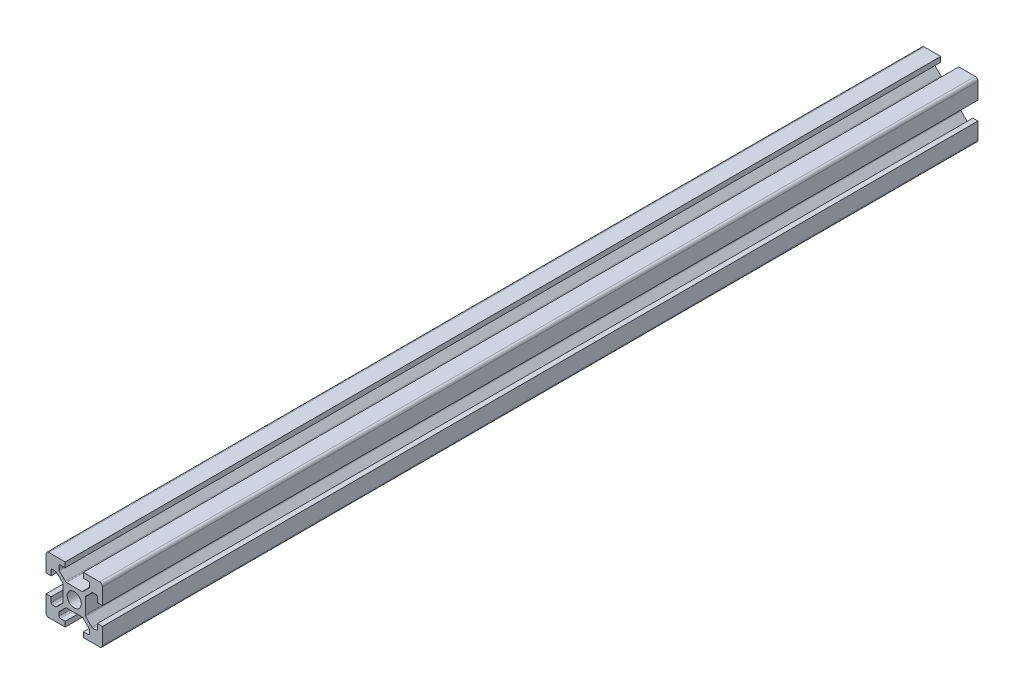
from build123d import *

# Parameters (mm, degrees)
SKETCH1_R           = 2.5
BOSS_EXTRUDE1_DEPTH = 310
FILLET1_R           = 1
FILLET2_R           = 0.5
FILLET3_R           = 0.5
FILLET4_R           = 0.5
FILLET5_R           = 0.5


with BuildPart() as part:
    # Sketch1 → Boss-Extrude1 (new body)
    with BuildSketch(Plane.XY):
        Polygon((13.2, 0), (13.2, 1.8), (15.45, 1.8), (15.45, 3.6), (12.95, 6.1), (7.05, 6.1), (4.55, 3.6), (4.55, 1.8), (6.8, 1.8), (6.8, 0), (0, 0), (0, 6.8), (1.8, 6.8), (1.8, 4.55), (3.6, 4.55), (6.1, 7.05), (6.1, 12.95), (3.6, 15.45), (1.8, 15.45), (1.8, 13.2), (0, 13.2), (0, 20), (6.8, 20), (6.8, 18.2), (4.55, 18.2), (4.55, 16.4), (7.05, 13.9), (12.95, 13.9), (15.45, 16.4), (15.45, 18.2), (13.2, 18.2), (13.2, 20), (20, 20), (20, 13.2), (18.2, 13.2), (18.2, 15.45), (16.4, 15.45), (13.9, 12.95), (13.9, 7.05), (16.4, 4.55), (18.2, 4.55), (18.2, 6.8), (20, 6.8), (20, 0), align=None)
        with Locations((10, 10)):
            Circle(SKETCH1_R, mode=Mode.SUBTRACT)
    extrude(amount=BOSS_EXTRUDE1_DEPTH)

    # Fillet1
    fillet1_edges = [part.edges().sort_by_distance(p)[0] for p in [
        (0, 0, 155),
        (0, 20, 155),
        (20, 20, 155),
        (20, 0, 155),
    ]]
    fillet(fillet1_edges, radius=FILLET1_R)

    # Fillet2
    fillet2_edges = [part.edges().sort_by_distance(p)[0] for p in [
        (4.55, 18.2, 155),
        (4.55, 16.4, 155),
        (7.05, 13.9, 155),
        (12.95, 13.9, 155),
        (15.45, 16.4, 155),
        (15.45, 18.2, 155),
    ]]
    fillet(fillet2_edges, radius=FILLET2_R)

    # Fillet3
    fillet3_edges = [part.edges().sort_by_distance(p)[0] for p in [
        (18.2, 15.45, 155),
        (16.4, 15.45, 155),
        (13.9, 12.95, 155),
        (13.9, 7.05, 155),
        (16.4, 4.55, 155),
        (18.2, 4.55, 155),
    ]]
    fillet(fillet3_edges, radius=FILLET3_R)

    # Fillet4
    fillet4_edges = [part.edges().sort_by_distance(p)[0] for p in [
        (1.8, 4.55, 155),
        (3.6, 4.55, 155),
        (6.1, 7.05, 155),
        (6.1, 12.95, 155),
        (3.6, 15.45, 155),
        (1.8, 15.45, 155),
    ]]
    fillet(fillet4_edges, radius=FILLET4_R)

    # Fillet5
    fillet5_edges = [part.edges().sort_by_distance(p)[0] for p in [
        (15.45, 1.8, 155),
        (15.45, 3.6, 155),
        (12.95, 6.1, 155),
        (7.05, 6.1, 155),
        (4.55, 3.6, 155),
        (4.55, 1.8, 155),
    ]]
    fillet(fillet5_edges, radius=FILLET5_R)


solid = part.part
